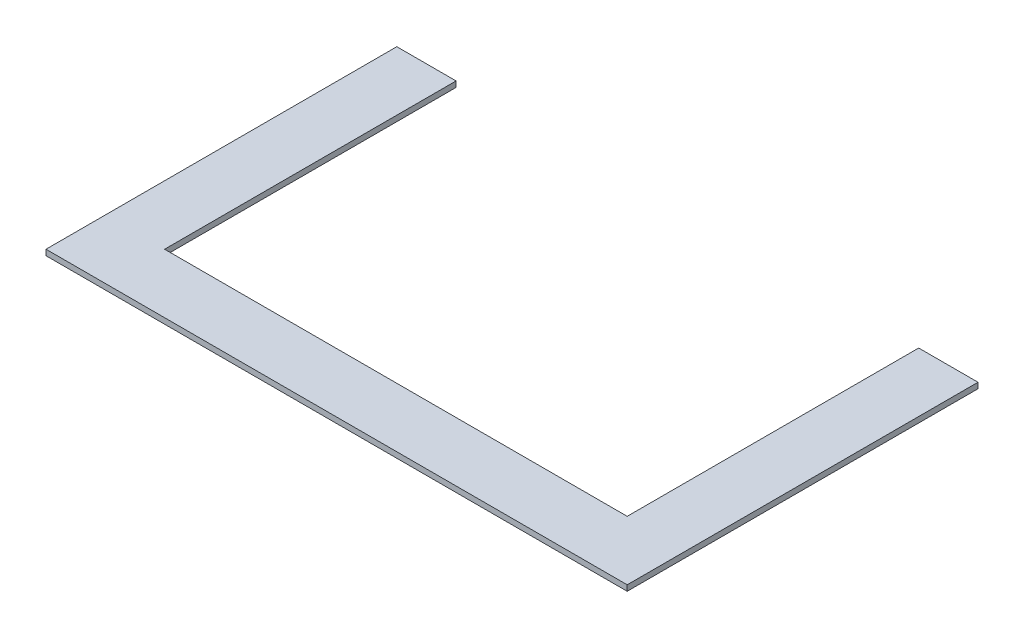
from build123d import *

# Parameters (mm, degrees)
BOSS_EXTRUDE1_DEPTH = 1.8288


with BuildPart() as part:
    # Sketch1 → Boss-Extrude1 (new body)
    with BuildSketch(Plane(origin=(0, 0, 0), x_dir=(1, 0, 0), z_dir=(0, 1, 0))):
        Polygon((51.114193491, 70.503129438), (70.265793491, 70.503129438), (70.265793491, -42.806270562), (-117.465606509, -42.806270562), (-117.465606509, 70.503129438), (-98.314006509, 70.503129438), (-98.314006509, -23.654670562), (51.114193491, -23.654670562), align=None)
    extrude(amount=BOSS_EXTRUDE1_DEPTH)


solid = part.part
